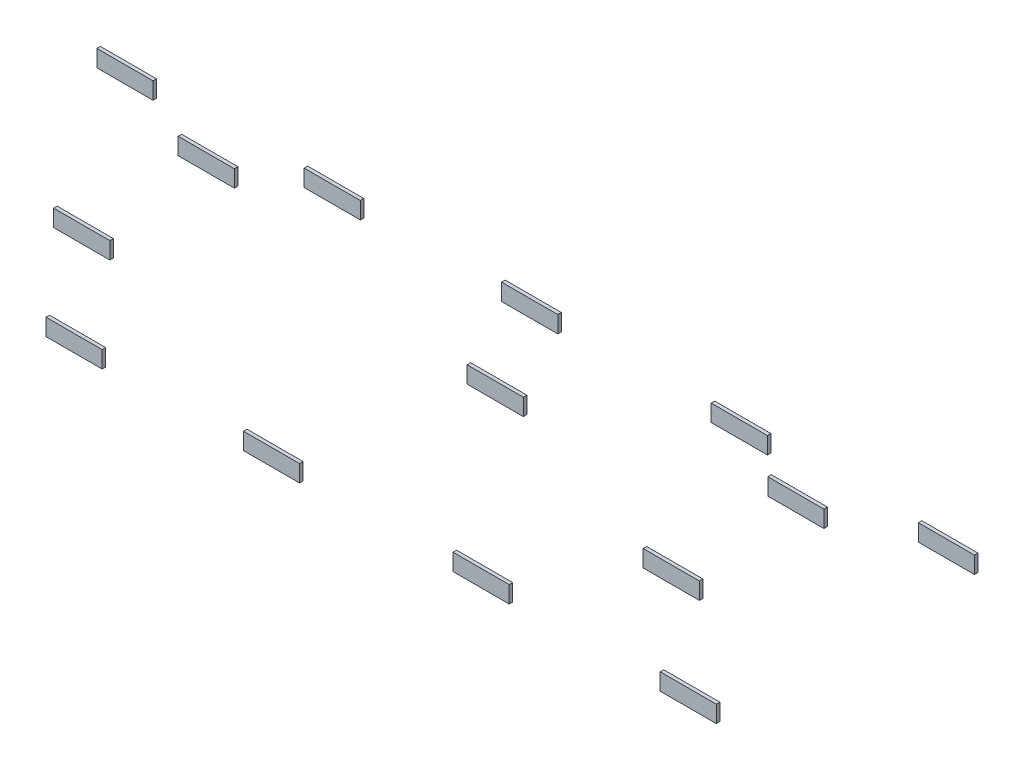
from build123d import *

# Parameters (mm, degrees)
SKETCH1_W              = 76.2
SKETCH1_H              = 4.7625
BOSS_EXTRUDE1_DEPTH    = 22.86
BOSS_EXTRUDE1_2_DEPTH  = 22.86
BOSS_EXTRUDE1_3_DEPTH  = 22.86
BOSS_EXTRUDE1_4_DEPTH  = 22.86
BOSS_EXTRUDE1_5_DEPTH  = 22.86
BOSS_EXTRUDE1_6_DEPTH  = 22.86
BOSS_EXTRUDE1_7_DEPTH  = 22.86
BOSS_EXTRUDE1_8_DEPTH  = 22.86
BOSS_EXTRUDE1_9_DEPTH  = 22.86
BOSS_EXTRUDE1_10_DEPTH = 22.86
BOSS_EXTRUDE1_11_DEPTH = 22.86
BOSS_EXTRUDE1_12_DEPTH = 22.86
BOSS_EXTRUDE1_13_DEPTH = 22.86
BOSS_EXTRUDE1_14_DEPTH = 22.86


with BuildPart() as part:
    # Sketch1 → Boss-Extrude1 (new body)
    with BuildSketch(Plane(origin=(0, 0, 0), x_dir=(1, 0, 0), z_dir=(0, 1, 0))):
        with Locations((22.975489918, -185.216782031)):
            Rectangle(SKETCH1_W, SKETCH1_H)
    extrude(amount=-BOSS_EXTRUDE1_DEPTH)


with BuildPart() as body_2:
    # Sketch1 → Boss-Extrude1 2 (new body)
    with BuildSketch(Plane(origin=(0, 0, 0), x_dir=(1, 0, 0), z_dir=(0, 1, 0))):
        with Locations((-244.820624844, -185.216782031)):
            Rectangle(SKETCH1_W, SKETCH1_H)
    extrude(amount=-BOSS_EXTRUDE1_2_DEPTH)


with BuildPart() as body_3:
    # Sketch1 → Boss-Extrude1 3 (new body)
    with BuildSketch(Plane(origin=(0, 0, 0), x_dir=(1, 0, 0), z_dir=(0, 1, 0))):
        with Locations((-244.820624844, 164.99640518)):
            Rectangle(SKETCH1_W, SKETCH1_H)
    extrude(amount=-BOSS_EXTRUDE1_3_DEPTH)


with BuildPart() as body_4:
    # Sketch1 → Boss-Extrude1 4 (new body)
    with BuildSketch(Plane(origin=(0, 0, 0), x_dir=(1, 0, 0), z_dir=(0, 1, 0))):
        with Locations((-526.03932766, 164.99640518)):
            Rectangle(SKETCH1_W, SKETCH1_H)
    extrude(amount=-BOSS_EXTRUDE1_4_DEPTH)


with BuildPart() as body_5:
    # Sketch1 → Boss-Extrude1 5 (new body)
    with BuildSketch(Plane(origin=(0, 0, 0), x_dir=(1, 0, 0), z_dir=(0, 1, 0))):
        with Locations((307.322725536, 164.99640518)):
            Rectangle(SKETCH1_W, SKETCH1_H)
    extrude(amount=-BOSS_EXTRUDE1_5_DEPTH)


with BuildPart() as body_6:
    # Sketch1 → Boss-Extrude1 6 (new body)
    with BuildSketch(Plane(origin=(0, 0, 0), x_dir=(1, 0, 0), z_dir=(0, 1, 0))):
        with Locations((22.975489918, 164.99640518)):
            Rectangle(SKETCH1_W, SKETCH1_H)
    extrude(amount=-BOSS_EXTRUDE1_6_DEPTH)


with BuildPart() as body_7:
    # Sketch1 → Boss-Extrude1 7 (new body)
    with BuildSketch(Plane(origin=(0, 0, 0), x_dir=(1, 0, 0), z_dir=(0, 1, 0))):
        with Locations((588.253249623, 164.99640518)):
            Rectangle(SKETCH1_W, SKETCH1_H)
    extrude(amount=-BOSS_EXTRUDE1_7_DEPTH)


with BuildPart() as body_8:
    # Sketch1 → Boss-Extrude1 8 (new body)
    with BuildSketch(Plane(origin=(0, 0, 0), x_dir=(1, 0, 0), z_dir=(0, 1, 0))):
        with Locations((307.322725536, -185.216782031)):
            Rectangle(SKETCH1_W, SKETCH1_H)
    extrude(amount=-BOSS_EXTRUDE1_8_DEPTH)


with BuildPart() as body_9:
    # Sketch1 → Boss-Extrude1 9 (new body)
    with BuildSketch(Plane(origin=(0, 0, 0), x_dir=(1, 0, 0), z_dir=(0, 1, 0))):
        with Locations((588.253249623, -185.216782031)):
            Rectangle(SKETCH1_W, SKETCH1_H)
    extrude(amount=-BOSS_EXTRUDE1_9_DEPTH)


with BuildPart() as body_10:
    # Sketch1 → Boss-Extrude1 10 (new body)
    with BuildSketch(Plane(origin=(0, 0, 0), x_dir=(1, 0, 0), z_dir=(0, 1, 0))):
        with Locations((432.072930827, 116.94359482)):
            Rectangle(SKETCH1_W, SKETCH1_H)
    extrude(amount=-BOSS_EXTRUDE1_10_DEPTH)


with BuildPart() as body_11:
    # Sketch1 → Boss-Extrude1 11 (new body)
    with BuildSketch(Plane(origin=(0, 0, 0), x_dir=(1, 0, 0), z_dir=(0, 1, 0))):
        with Locations((432.072930827, -51.96640518)):
            Rectangle(SKETCH1_W, SKETCH1_H)
    extrude(amount=-BOSS_EXTRUDE1_11_DEPTH)


with BuildPart() as body_12:
    # Sketch1 → Boss-Extrude1 12 (new body)
    with BuildSketch(Plane(origin=(0, 0, 0), x_dir=(1, 0, 0), z_dir=(0, 1, 0))):
        with Locations((96.712063652, 44.55359482)):
            Rectangle(SKETCH1_W, SKETCH1_H)
    extrude(amount=-BOSS_EXTRUDE1_12_DEPTH)


with BuildPart() as body_13:
    # Sketch1 → Boss-Extrude1 13 (new body)
    with BuildSketch(Plane(origin=(0, 0, 0), x_dir=(1, 0, 0), z_dir=(0, 1, 0))):
        with Locations((-367.665071888, 116.94359482)):
            Rectangle(SKETCH1_W, SKETCH1_H)
    extrude(amount=-BOSS_EXTRUDE1_13_DEPTH)


with BuildPart() as body_14:
    # Sketch1 → Boss-Extrude1 14 (new body)
    with BuildSketch(Plane(origin=(0, 0, 0), x_dir=(1, 0, 0), z_dir=(0, 1, 0))):
        with Locations((-367.665071888, -51.96640518)):
            Rectangle(SKETCH1_W, SKETCH1_H)
    extrude(amount=-BOSS_EXTRUDE1_14_DEPTH)


solid = Compound([part.part, body_2.part, body_3.part, body_4.part, body_5.part, body_6.part, body_7.part, body_8.part, body_9.part, body_10.part, body_11.part, body_12.part, body_13.part, body_14.part])
